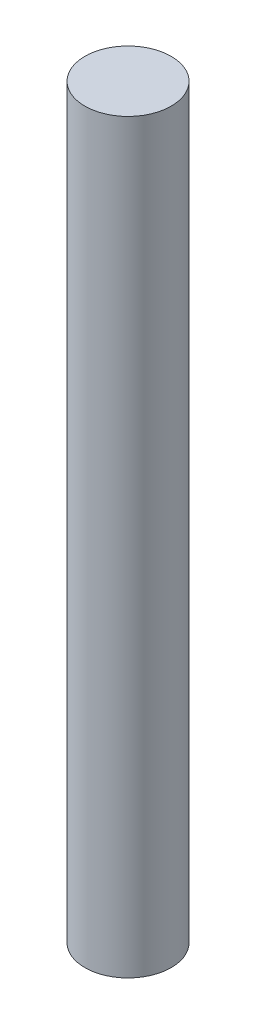
from build123d import *

# Parameters (mm, degrees)
SKETCH1_R           = 0.725
BOSS_EXTRUDE1_DEPTH = 12.53


with BuildPart() as part:
    # Sketch1 → Boss-Extrude1 (new body)
    with BuildSketch(Plane(origin=(0, 0, 0), x_dir=(1, 0, 0), z_dir=(0, 1, 0))):
        with Locations(Location((0, 0, 0), (0, 0, 90))):
            Circle(SKETCH1_R)
    extrude(amount=BOSS_EXTRUDE1_DEPTH)


solid = part.part
